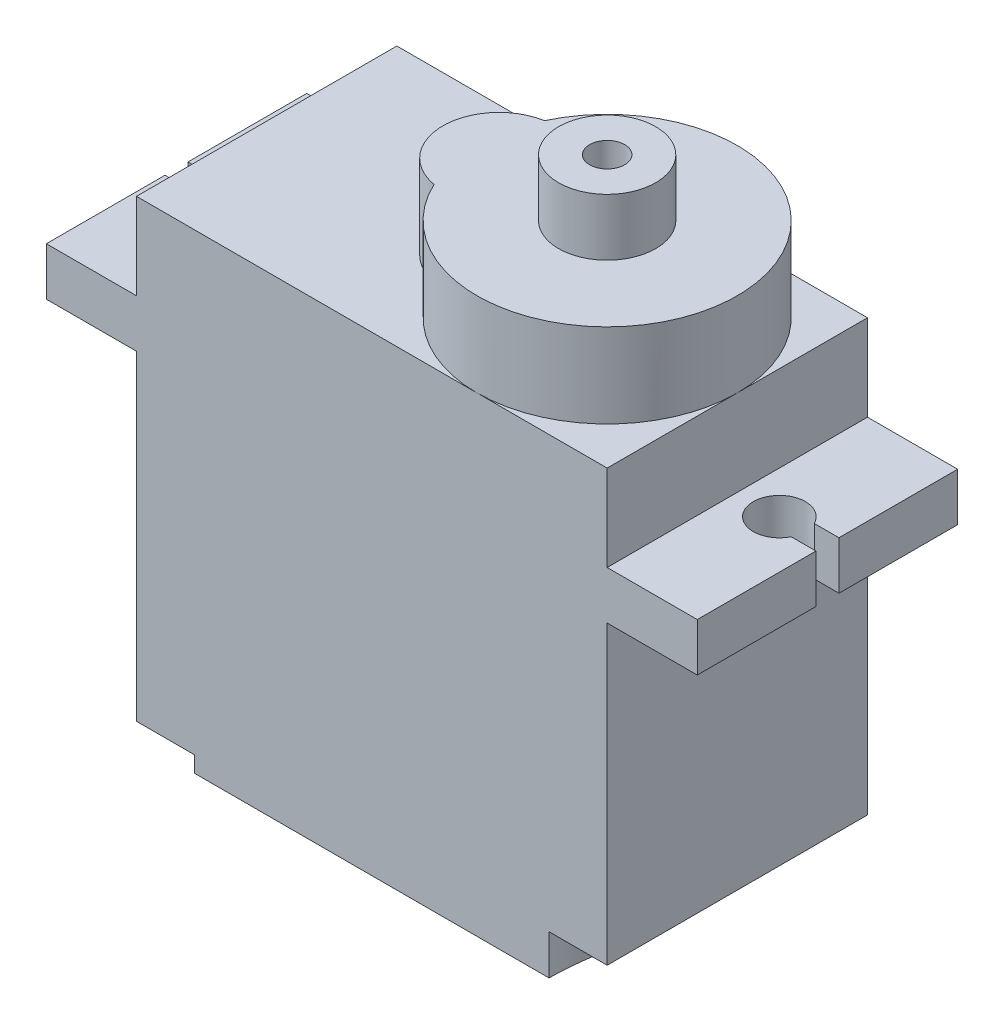
from build123d import *

# Parameters (mm, degrees)
SALIENTE_EXTRUIR1_DEPTH = 6.5
SALIENTE_EXTRUIR2_DEPTH = 4.2
CORTAR_EXTRUIR1_REACH   = 27.98
CORTAR_EXTRUIR3_DEPTH   = 0.8
CROQUIS4_5_W            = 1.5
CROQUIS4_5_H            = 3.75
CORTAR_EXTRUIR4_DEPTH   = 2
CORTAR_EXTRUIR5_DEPTH   = 27.219553772
CROQUIS7_R              = 2.425
CROQUIS7_R_2            = 0.875
SALIENTE_EXTRUIR4_DEPTH = 2.85


with BuildPart() as part:
    # Croquis1 → Saliente-Extruir1 (new, symmetric)
    with BuildSketch(Plane.XY):
        Polygon((-11.75, 5.05), (-11.75, -11.75), (11.75, -11.75), (11.75, 5.05), (16.25, 5.05), (16.25, 7.45), (11.75, 7.45), (11.75, 11.75), (-11.75, 11.75), (-11.75, 7.45), (-16.25, 7.45), (-16.25, 5.05), align=None)
    extrude(amount=SALIENTE_EXTRUIR1_DEPTH, both=True)

    # Croquis2 → Saliente-Extruir2 (add)
    with BuildSketch(Plane(origin=(0, 11.75, 0), x_dir=(1, 0, 0), z_dir=(0, 1, 0))):
        with BuildLine():
            ThreePointArc((-0.636111111, -2.757480007), (11.75, 0), (-0.636111111, 2.757480007))
            ThreePointArc((-0.636111111, 2.757480007), (-2.95, 0), (-0.636111111, -2.757480007))
        make_face()
    extrude(amount=SALIENTE_EXTRUIR2_DEPTH)

    # Croquis3 → Cortar-Extruir1 (cut, up to next)
    with BuildSketch(Plane(origin=(0, 7.45, 0), x_dir=(1, 0, 0), z_dir=(0, 1, 0)), mode=Mode.PRIVATE) as cortar_extruir1_sk1:
        with BuildLine():
            Line((16.25, 0.575), (15.015922382, 0.575))
            ThreePointArc((15.015922382, 0.575), (12.55, 0), (15.015922382, -0.575))
            Line((15.015922382, -0.575), (16.25, -0.575))
            Line((16.25, -0.575), (16.25, 0.575))
        make_face()
    cortar_extruir1_tool1 = extrude(cortar_extruir1_sk1.sketch, amount=-CORTAR_EXTRUIR1_REACH, mode=Mode.PRIVATE) & part.part
    # Croquis3 → Cortar-Extruir1 (cut, up to next)
    with BuildSketch(Plane(origin=(0, 7.45, 0), x_dir=(1, 0, 0), z_dir=(0, 1, 0)), mode=Mode.PRIVATE) as cortar_extruir1_sk2:
        with BuildLine():
            Line((-16.25, 0.575), (-15.015922382, 0.575))
            ThreePointArc((-15.015922382, 0.575), (-12.55, 0), (-15.015922382, -0.575))
            Line((-15.015922382, -0.575), (-16.25, -0.575))
            Line((-16.25, -0.575), (-16.25, 0.575))
        make_face()
    cortar_extruir1_tool2 = extrude(cortar_extruir1_sk2.sketch, amount=-CORTAR_EXTRUIR1_REACH, mode=Mode.PRIVATE) & part.part
    add(cortar_extruir1_tool1.solids().sort_by_distance((14.212834, 7.45, 0))[0], mode=Mode.SUBTRACT)
    add(cortar_extruir1_tool2.solids().sort_by_distance((-14.212834, 7.45, 0))[0], mode=Mode.SUBTRACT)

    # Croquis4 → Cortar-Extruir3 (cut)
    with BuildSketch(Plane.XZ.offset(11.75)):
        with BuildLine():
            Line((-11.75, 6.5), (-11.75, 3.6))
            ThreePointArc((-11.75, 3.6), (-9.699390335, 4.449390335), (-8.85, 6.5))
            Line((-8.85, 6.5), (-11.75, 6.5))
        make_face()
        with BuildLine():
            ThreePointArc((-8.85, -6.5), (-9.699390335, -4.449390335), (-11.75, -3.6))
            Line((-11.75, -3.6), (-11.75, -6.5))
            Line((-11.75, -6.5), (-8.85, -6.5))
        make_face()
    extrude(amount=-CORTAR_EXTRUIR3_DEPTH, mode=Mode.SUBTRACT)

    # Croquis4<5> → Cortar-Extruir4 (cut)
    with BuildSketch(Plane.XZ.offset(11.75)):
        with BuildLine():
            Line((11.75, 6.5), (8.85, 6.5))
            ThreePointArc((8.85, 6.5), (9.699390335, 4.449390335), (11.75, 3.6))
            Line((11.75, 3.6), (11.75, 6.5))
        make_face()
        with BuildLine():
            ThreePointArc((11.75, -3.6), (9.699390335, -4.449390335), (8.85, -6.5))
            Line((8.85, -6.5), (11.75, -6.5))
            Line((11.75, -6.5), (11.75, -3.6))
        make_face()
        with Locations((11, 0)):
            Rectangle(CROQUIS4_5_W, CROQUIS4_5_H)
    extrude(amount=-CORTAR_EXTRUIR4_DEPTH, mode=Mode.SUBTRACT)

    # Croquis6 → Cortar-Extruir5 (cut, through all)
    with BuildSketch(Plane(origin=(0, 0, -6.5), x_dir=(-1, 0, 0), z_dir=(0, 0, -1))):
        Polygon((-11.75, -9.75), (-8.85, -11.75), (-11.75, -11.75), align=None)
    extrude(amount=-CORTAR_EXTRUIR5_DEPTH, mode=Mode.SUBTRACT)

    # Croquis7 → Saliente-Extruir4 (add)
    with BuildSketch(Plane(origin=(0, 15.95, 0), x_dir=(1, 0, 0), z_dir=(0, 1, 0))):
        with Locations((5.25, 0)):
            Circle(CROQUIS7_R)
        with Locations((5.25, 0)):
            Circle(CROQUIS7_R_2, mode=Mode.SUBTRACT)
    extrude(amount=SALIENTE_EXTRUIR4_DEPTH)


solid = part.part
